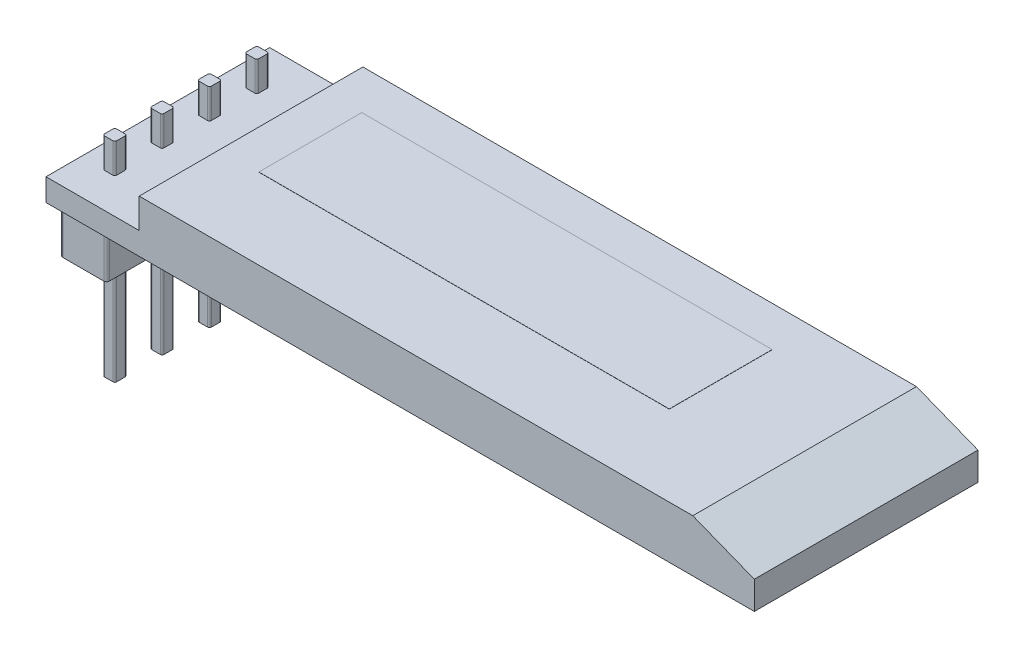
from build123d import *

# Parameters (mm, degrees)
SKETCH_507_W           = 33
SKETCH_507_H           = 12
EXTRUDE_1_DEPTH        = 2.8
SKETCH_1_3_W           = 5
SKETCH_1_3_H           = 12
EXTRUDE_2_DEPTH        = 1.2
EXTRUDE_3_DEPTH        = 1.2
EXTRUDE_3_DEPTH_BACK   = 2.6
EXTRUDE_4_DEPTH        = 2.8
EXTRUDE_4_DEPTH_BACK   = 8.4
EXTRUDE_4_2_DEPTH      = 2.8
EXTRUDE_4_2_DEPTH_BACK = 8.4
EXTRUDE_4_3_DEPTH      = 2.8
EXTRUDE_4_3_DEPTH_BACK = 8.4
EXTRUDE_4_4_DEPTH      = 2.8
EXTRUDE_4_4_DEPTH_BACK = 8.4
CHAMFER_2_SIZE         = 1.3
CHAMFER_2_SIZE2        = 3.3
SKETCH_2962_W          = 22.017119527
SKETCH_2962_H          = 5.52
EXTRUDE_5_DEPTH        = 0.01


with BuildPart() as part:
    # Sketch 507 → Бобышка-Вытянуть1 (new body)
    with BuildSketch(Plane(origin=(0, 0, 0), x_dir=(1, 0, 0), z_dir=(0, 1, 0))):
        with Locations((2.5, 0)):
            Rectangle(SKETCH_507_W, SKETCH_507_H)
    extrude(amount=EXTRUDE_1_DEPTH)

    # Эскиз1<3> → Бобышка-Вытянуть2 (add)
    with BuildSketch(Plane(origin=(0, 0, 0), x_dir=(1, 0, 0), z_dir=(0, 1, 0))):
        with Locations((-16.5, 0)):
            Rectangle(SKETCH_1_3_W, SKETCH_1_3_H)
        with BuildLine():
            ThreePointArc((-16.25, -5.35), (-16.293933983, -5.456066017), (-16.4, -5.5))
            Line((-16.4, -5.5), (-18.6, -5.5))
            ThreePointArc((-18.6, -5.5), (-18.706066017, -5.456066017), (-18.75, -5.35))
            Line((-18.75, -5.35), (-18.75, 5.35))
            ThreePointArc((-18.75, 5.35), (-18.706066017, 5.456066017), (-18.6, 5.5))
            Line((-18.6, 5.5), (-16.4, 5.5))
            ThreePointArc((-16.4, 5.5), (-16.293933983, 5.456066017), (-16.25, 5.35))
            Line((-16.25, 5.35), (-16.25, -5.35))
        make_face(mode=Mode.SUBTRACT)
    extrude(amount=EXTRUDE_2_DEPTH)

    # Эскиз1<4> → Бобышка-Вытянуть3 (add, two sides: drawn at the far end of the back side and taken through both)
    with BuildSketch(Plane(origin=(0, 0, 0), x_dir=(1, 0, 0), z_dir=(0, 1, 0)).offset(-EXTRUDE_3_DEPTH_BACK)):
        with BuildLine():
            Line((-18.6, -5.5), (-16.4, -5.5))
            ThreePointArc((-16.4, -5.5), (-16.293933983, -5.456066017), (-16.25, -5.35))
            Line((-16.25, -5.35), (-16.25, 5.35))
            ThreePointArc((-16.25, 5.35), (-16.293933983, 5.456066017), (-16.4, 5.5))
            Line((-16.4, 5.5), (-18.6, 5.5))
            ThreePointArc((-18.6, 5.5), (-18.706066017, 5.456066017), (-18.75, 5.35))
            Line((-18.75, 5.35), (-18.75, -5.35))
            ThreePointArc((-18.75, -5.35), (-18.706066017, -5.456066017), (-18.6, -5.5))
        make_face()
        with BuildLine():
            ThreePointArc((-17.175, -4.035), (-17.204289322, -4.105710678), (-17.275, -4.135))
            Line((-17.275, -4.135), (-17.725, -4.135))
            ThreePointArc((-17.725, -4.135), (-17.795710678, -4.105710678), (-17.825, -4.035))
            Line((-17.825, -4.035), (-17.825, -3.585))
            ThreePointArc((-17.825, -3.585), (-17.795710678, -3.514289322), (-17.725, -3.485))
            Line((-17.725, -3.485), (-17.275, -3.485))
            ThreePointArc((-17.275, -3.485), (-17.204289322, -3.514289322), (-17.175, -3.585))
            Line((-17.175, -3.585), (-17.175, -4.035))
        make_face(mode=Mode.SUBTRACT)
        with BuildLine():
            ThreePointArc((-17.175, -1.495), (-17.204289322, -1.565710678), (-17.275, -1.595))
            Line((-17.275, -1.595), (-17.725, -1.595))
            ThreePointArc((-17.725, -1.595), (-17.795710678, -1.565710678), (-17.825, -1.495))
            Line((-17.825, -1.495), (-17.825, -1.045))
            ThreePointArc((-17.825, -1.045), (-17.795710678, -0.974289322), (-17.725, -0.945))
            Line((-17.725, -0.945), (-17.275, -0.945))
            ThreePointArc((-17.275, -0.945), (-17.204289322, -0.974289322), (-17.175, -1.045))
            Line((-17.175, -1.045), (-17.175, -1.495))
        make_face(mode=Mode.SUBTRACT)
        with BuildLine():
            ThreePointArc((-17.175, 1.045), (-17.204289322, 0.974289322), (-17.275, 0.945))
            Line((-17.275, 0.945), (-17.725, 0.945))
            ThreePointArc((-17.725, 0.945), (-17.795710678, 0.974289322), (-17.825, 1.045))
            Line((-17.825, 1.045), (-17.825, 1.495))
            ThreePointArc((-17.825, 1.495), (-17.795710678, 1.565710678), (-17.725, 1.595))
            Line((-17.725, 1.595), (-17.275, 1.595))
            ThreePointArc((-17.275, 1.595), (-17.204289322, 1.565710678), (-17.175, 1.495))
            Line((-17.175, 1.495), (-17.175, 1.045))
        make_face(mode=Mode.SUBTRACT)
        with BuildLine():
            ThreePointArc((-17.175, 3.585), (-17.204289322, 3.514289322), (-17.275, 3.485))
            Line((-17.275, 3.485), (-17.725, 3.485))
            ThreePointArc((-17.725, 3.485), (-17.795710678, 3.514289322), (-17.825, 3.585))
            Line((-17.825, 3.585), (-17.825, 4.035))
            ThreePointArc((-17.825, 4.035), (-17.795710678, 4.105710678), (-17.725, 4.135))
            Line((-17.725, 4.135), (-17.275, 4.135))
            ThreePointArc((-17.275, 4.135), (-17.204289322, 4.105710678), (-17.175, 4.035))
            Line((-17.175, 4.035), (-17.175, 3.585))
        make_face(mode=Mode.SUBTRACT)
    extrude(amount=EXTRUDE_3_DEPTH + EXTRUDE_3_DEPTH_BACK)

    # Фаска2
    chamfer_2_edges = [part.edges().sort_by_distance(p)[0] for p in [
        (19, 2.8, 0),
    ]]
    chamfer_2_side = [part.faces().sort_by_distance(p)[0] for p in [
        (19, 1.4, 0),
    ]]
    chamfer(chamfer_2_edges, length=CHAMFER_2_SIZE, length2=CHAMFER_2_SIZE2, reference=chamfer_2_side[0])

    # Sketch 2962 → Бобышка-Вытянуть5 (add)
    with BuildSketch(Plane(origin=(0, 2.8, 0), x_dir=(1, 0, 0), z_dir=(0, 1, 0))):
        with Locations((-0.891440237, 1.08)):
            Rectangle(SKETCH_2962_W, SKETCH_2962_H)
    extrude(amount=EXTRUDE_5_DEPTH)


with BuildPart() as body_2:
    # Эскиз1<6> → Бобышка-Вытянуть4 (new, two sides: drawn at the far end of the back side and taken through both)
    with BuildSketch(Plane(origin=(0, 0, 0), x_dir=(1, 0, 0), z_dir=(0, 1, 0)).offset(-EXTRUDE_4_DEPTH_BACK)):
        with BuildLine():
            Line((-17.275, 3.485), (-17.725, 3.485))
            ThreePointArc((-17.725, 3.485), (-17.795710678, 3.514289322), (-17.825, 3.585))
            Line((-17.825, 3.585), (-17.825, 4.035))
            ThreePointArc((-17.825, 4.035), (-17.795710678, 4.105710678), (-17.725, 4.135))
            Line((-17.725, 4.135), (-17.275, 4.135))
            ThreePointArc((-17.275, 4.135), (-17.204289322, 4.105710678), (-17.175, 4.035))
            Line((-17.175, 4.035), (-17.175, 3.585))
            ThreePointArc((-17.175, 3.585), (-17.204289322, 3.514289322), (-17.275, 3.485))
        make_face()
    extrude(amount=EXTRUDE_4_DEPTH + EXTRUDE_4_DEPTH_BACK)


with BuildPart() as body_3:
    # Эскиз1<6> → Extrude 4 2 (new, two sides: drawn at the far end of the back side and taken through both)
    with BuildSketch(Plane(origin=(0, 0, 0), x_dir=(1, 0, 0), z_dir=(0, 1, 0)).offset(-EXTRUDE_4_2_DEPTH_BACK)):
        with BuildLine():
            Line((-17.275, 0.945), (-17.725, 0.945))
            ThreePointArc((-17.725, 0.945), (-17.795710678, 0.974289322), (-17.825, 1.045))
            Line((-17.825, 1.045), (-17.825, 1.495))
            ThreePointArc((-17.825, 1.495), (-17.795710678, 1.565710678), (-17.725, 1.595))
            Line((-17.725, 1.595), (-17.275, 1.595))
            ThreePointArc((-17.275, 1.595), (-17.204289322, 1.565710678), (-17.175, 1.495))
            Line((-17.175, 1.495), (-17.175, 1.045))
            ThreePointArc((-17.175, 1.045), (-17.204289322, 0.974289322), (-17.275, 0.945))
        make_face()
    extrude(amount=EXTRUDE_4_2_DEPTH + EXTRUDE_4_2_DEPTH_BACK)


with BuildPart() as body_4:
    # Эскиз1<6> → Extrude 4 3 (new, two sides: drawn at the far end of the back side and taken through both)
    with BuildSketch(Plane(origin=(0, 0, 0), x_dir=(1, 0, 0), z_dir=(0, 1, 0)).offset(-EXTRUDE_4_3_DEPTH_BACK)):
        with BuildLine():
            Line((-17.275, -1.595), (-17.725, -1.595))
            ThreePointArc((-17.725, -1.595), (-17.795710678, -1.565710678), (-17.825, -1.495))
            Line((-17.825, -1.495), (-17.825, -1.045))
            ThreePointArc((-17.825, -1.045), (-17.795710678, -0.974289322), (-17.725, -0.945))
            Line((-17.725, -0.945), (-17.275, -0.945))
            ThreePointArc((-17.275, -0.945), (-17.204289322, -0.974289322), (-17.175, -1.045))
            Line((-17.175, -1.045), (-17.175, -1.495))
            ThreePointArc((-17.175, -1.495), (-17.204289322, -1.565710678), (-17.275, -1.595))
        make_face()
    extrude(amount=EXTRUDE_4_3_DEPTH + EXTRUDE_4_3_DEPTH_BACK)


with BuildPart() as body_5:
    # Эскиз1<6> → Extrude 4 4 (new, two sides: drawn at the far end of the back side and taken through both)
    with BuildSketch(Plane(origin=(0, 0, 0), x_dir=(1, 0, 0), z_dir=(0, 1, 0)).offset(-EXTRUDE_4_4_DEPTH_BACK)):
        with BuildLine():
            Line((-17.275, -4.135), (-17.725, -4.135))
            ThreePointArc((-17.725, -4.135), (-17.795710678, -4.105710678), (-17.825, -4.035))
            Line((-17.825, -4.035), (-17.825, -3.585))
            ThreePointArc((-17.825, -3.585), (-17.795710678, -3.514289322), (-17.725, -3.485))
            Line((-17.725, -3.485), (-17.275, -3.485))
            ThreePointArc((-17.275, -3.485), (-17.204289322, -3.514289322), (-17.175, -3.585))
            Line((-17.175, -3.585), (-17.175, -4.035))
            ThreePointArc((-17.175, -4.035), (-17.204289322, -4.105710678), (-17.275, -4.135))
        make_face()
    extrude(amount=EXTRUDE_4_4_DEPTH + EXTRUDE_4_4_DEPTH_BACK)


solid = Compound([part.part, body_2.part, body_3.part, body_4.part, body_5.part])
